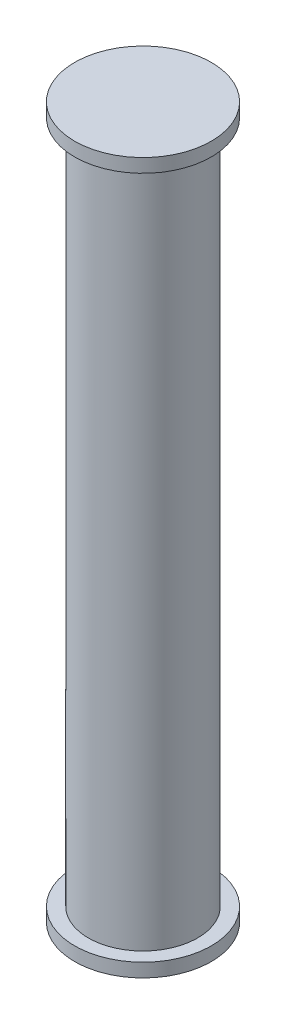
from build123d import *

# Parameters (mm, degrees)
SKETCH1_R           = 10.16
BOSS_EXTRUDE1_DEPTH = 66.04
SKETCH2_R           = 12.7
BOSS_EXTRUDE2_DEPTH = 2.54
BOSS_EXTRUDE3_START = -2.54
SKETCH3_R           = 12.7
BOSS_EXTRUDE3_DEPTH = 2.54


with BuildPart() as part:
    # Sketch1 → Boss-Extrude1 (new, symmetric)
    with BuildSketch(Plane(origin=(0, 0, 0), x_dir=(1, 0, 0), z_dir=(0, 1, 0))):
        with Locations(Location((0, 0, 0), (0, 0, 270))):
            Circle(SKETCH1_R)
    extrude(amount=BOSS_EXTRUDE1_DEPTH, both=True)

    # Sketch2 → Boss-Extrude2 (add)
    with BuildSketch(Plane(origin=(0, 66.04, 0), x_dir=(1, 0, 0), z_dir=(0, 1, 0))):
        with Locations(Location((0, 0, 0), (0, 0, 270))):
            Circle(SKETCH2_R)
    extrude(amount=-BOSS_EXTRUDE2_DEPTH)

    # Sketch3 → Boss-Extrude3 (add)
    with BuildSketch(Plane.XZ.offset(66.04).offset(BOSS_EXTRUDE3_START)):
        with Locations(Location((0, 0, 0), (0, 0, 90))):
            Circle(SKETCH3_R)
    extrude(amount=BOSS_EXTRUDE3_DEPTH)


solid = part.part
